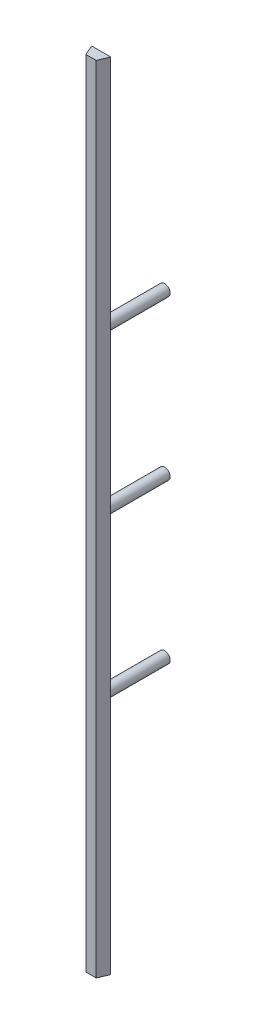
from build123d import *

# Parameters (mm, degrees)
BOSS_EXTRUDE1_DEPTH = 5000
SKETCH2_R           = 35
BOSS_EXTRUDE2_DEPTH = 400
LPATTERN1_COUNT     = 3
LPATTERN1_PITCH     = 1000


with BuildPart() as part:
    # Sketch1 → Boss-Extrude1 (new body)
    with BuildSketch(Plane(origin=(0, 0, 0), x_dir=(1, 0, 0), z_dir=(0, 1, 0))):
        Polygon((-31.452576395, 0), (33.547423605, 0), (61.047423605, 64.371965948), (-58.952576395, 64.371965948), align=None)
    extrude(amount=BOSS_EXTRUDE1_DEPTH)

    # Sketch2 → Boss-Extrude2 (add)
    with BuildSketch(Plane(origin=(0, 0, -64.371965948), x_dir=(-1, 0, 0), z_dir=(0, 0, -1))):
        with Locations(Location((0, 1500, 0), (0, 0, 180))):
            Circle(SKETCH2_R)
    boss_extrude2 = extrude(amount=BOSS_EXTRUDE2_DEPTH)

    # LPattern1: Boss-Extrude2 ×3
    with Locations(*[(0, i * LPATTERN1_PITCH, 0) for i in range(1, LPATTERN1_COUNT)]):
        add(boss_extrude2)


solid = part.part
